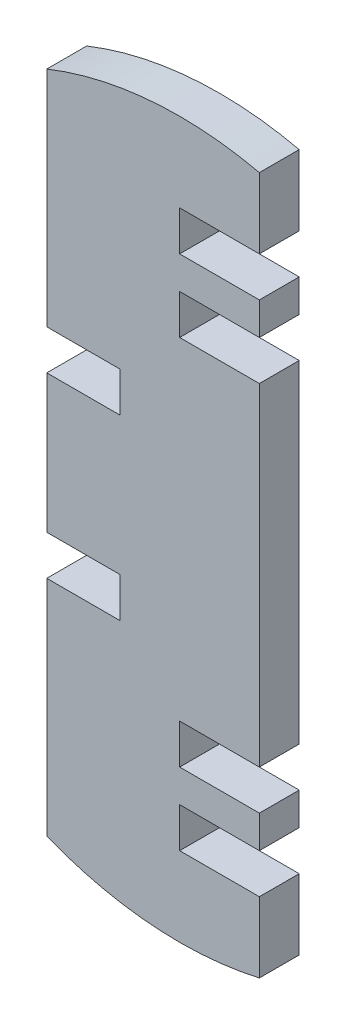
from build123d import *

# Parameters (mm, degrees)
BASE_EXTRUDE_DEPTH = 3


with BuildPart() as part:
    # Sketch1 → Base-Extrude (new body)
    with BuildSketch(Plane.XY):
        with BuildLine():
            Line((693.938729313, -90.783662266), (693.938729313, -115.783662266))
            Line((693.938729313, -115.783662266), (687.938729313, -115.783662266))
            Line((687.938729313, -115.783662266), (687.938729313, -118.783662266))
            Line((687.938729313, -118.783662266), (693.938729313, -118.783662266))
            Line((693.938729313, -118.783662266), (693.938729313, -121.233634181))
            Line((693.938729313, -121.233634181), (687.938729313, -121.233634181))
            Line((687.938729313, -121.233634181), (687.938729313, -124.233634181))
            Line((687.938729313, -124.233634181), (693.938729313, -124.233634181))
            Line((693.938729313, -124.233634181), (693.938729313, -129.532471762))
            ThreePointArc((693.938729313, -129.532471762), (685.843524958, -130.127844479), (677.938729313, -128.283662266))
            Line((677.938729313, -128.283662266), (677.938729313, -111.479521793))
            Line((677.938729313, -111.479521793), (683.467463006, -111.479521793))
            Line((683.467463006, -111.479521793), (683.467463006, -108.479521793))
            Line((683.467463006, -108.479521793), (677.938729313, -108.479521793))
            Line((677.938729313, -108.479521793), (677.938729313, -98.087802738))
            Line((677.938729313, -98.087802738), (683.467463006, -98.087802738))
            Line((683.467463006, -98.087802738), (683.467463006, -95.087802738))
            Line((683.467463006, -95.087802738), (677.938729313, -95.087802738))
            Line((677.938729313, -95.087802738), (677.938729313, -78.283662266))
            ThreePointArc((677.938729313, -78.283662266), (685.843524958, -76.439480052), (693.938729313, -77.034852769))
            Line((693.938729313, -77.034852769), (693.938729313, -82.33369035))
            Line((693.938729313, -82.33369035), (687.938729313, -82.33369035))
            Line((687.938729313, -82.33369035), (687.938729313, -85.33369035))
            Line((687.938729313, -85.33369035), (693.938729313, -85.33369035))
            Line((693.938729313, -85.33369035), (693.938729313, -87.783662266))
            Line((693.938729313, -87.783662266), (687.938729313, -87.783662266))
            Line((687.938729313, -87.783662266), (687.938729313, -90.783662266))
            Line((687.938729313, -90.783662266), (693.938729313, -90.783662266))
        make_face()
    extrude(amount=BASE_EXTRUDE_DEPTH)


solid = part.part
